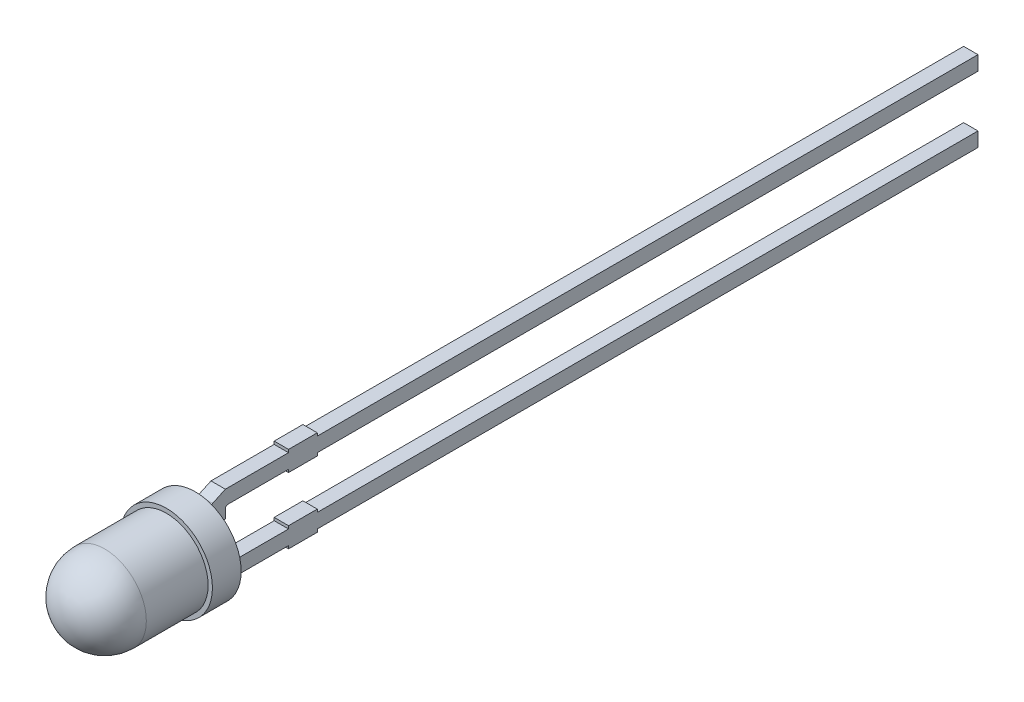
from build123d import *

# Parameters (mm, degrees)
EXTRUDE1_DEPTH = 0.25
FILLET1_R      = 0.25


with BuildPart() as part:
    # Sketch1 → Revolve1 (revolve)
    with BuildSketch(Plane(origin=(0, 0, 0), x_dir=(0, 0, -1), z_dir=(1, 0, 0)), mode=Mode.PRIVATE) as revolve1_sk:
        with BuildLine():
            Line((0, 1.45), (2.15, 1.45))
            Line((2.15, 1.45), (2.15, 1.599999975))
            Line((2.15, 1.599999975), (3.15, 1.599999975))
            Line((3.15, 1.599999975), (3.15, 0))
            Line((3.15, 0), (-1.45, 0))
            ThreePointArc((-1.45, 0), (-1.025304833, 1.025304833), (0, 1.45))
        make_face()
    revolve(revolve1_sk.sketch.rotate(Axis((0, 0, 0), (0, 0, -1)), 90), axis=Axis((0, 0, 0), (0, 0, -1)))

    # Sketch2 → Extrude1 (add, symmetric)
    with BuildSketch(Plane(origin=(0, 0, 0), x_dir=(0, 0, -1), z_dir=(1, 0, 0))):
        with BuildLine():
            Line((3.15, 1.026953873), (3.95, 1.4))
            Line((3.95, 1.4), (6.15, 1.4))
            Line((6.15, 1.4), (6.15, 1.5))
            Line((6.15, 1.5), (7.15, 1.5))
            Line((7.15, 1.5), (7.15, 1.4))
            Line((7.15, 1.4), (30.15, 1.4))
            Line((30.15, 1.4), (30.15, 0.9))
            Line((30.15, 0.9), (7.15, 0.9))
            Line((7.15, 0.9), (7.15, 0.8))
            Line((7.15, 0.8), (6.15, 0.8))
            Line((6.15, 0.8), (6.15, 0.9))
            Line((6.15, 0.9), (4.05, 0.9))
            ThreePointArc((4.05, 0.9), (3.979289322, 0.870710678), (3.95, 0.8))
            Line((3.95, 0.8), (3.95, 0.5))
            Line((3.95, 0.5), (3.15, 0.5))
            Line((3.15, 0.5), (3.15, 1.026953873))
        make_face()
        with BuildLine():
            Line((3.95, -0.8), (3.95, -0.5))
            Line((3.95, -0.5), (3.15, -0.5))
            Line((3.15, -0.5), (3.15, -1.026953873))
            Line((3.15, -1.026953873), (3.95, -1.4))
            Line((3.95, -1.4), (6.15, -1.4))
            Line((6.15, -1.4), (6.15, -1.5))
            Line((6.15, -1.5), (7.15, -1.5))
            Line((7.15, -1.5), (7.15, -1.4))
            Line((7.15, -1.4), (30.15, -1.4))
            Line((30.15, -1.4), (30.15, -0.9))
            Line((30.15, -0.9), (7.15, -0.9))
            Line((7.15, -0.9), (7.15, -0.8))
            Line((7.15, -0.8), (6.15, -0.8))
            Line((6.15, -0.8), (6.15, -0.9))
            Line((6.15, -0.9), (4.05, -0.9))
            ThreePointArc((4.05, -0.9), (3.979289322, -0.870710678), (3.95, -0.8))
        make_face()
    extrude(amount=EXTRUDE1_DEPTH, both=True)

    # Fillet1
    fillet1_edges = [part.edges().sort_by_distance(p)[0] for p in [
        (-0.25, 0.763476937, -3.15),
        (0, 1.026953873, -3.15),
        (0, 0.5, -3.15),
        (0.25, 0.763476937, -3.15),
        (-0.25, -0.763476937, -3.15),
        (0, -0.5, -3.15),
        (0, -1.026953873, -3.15),
        (0.25, -0.763476937, -3.15),
    ]]
    fillet(fillet1_edges, radius=FILLET1_R)


solid = part.part
